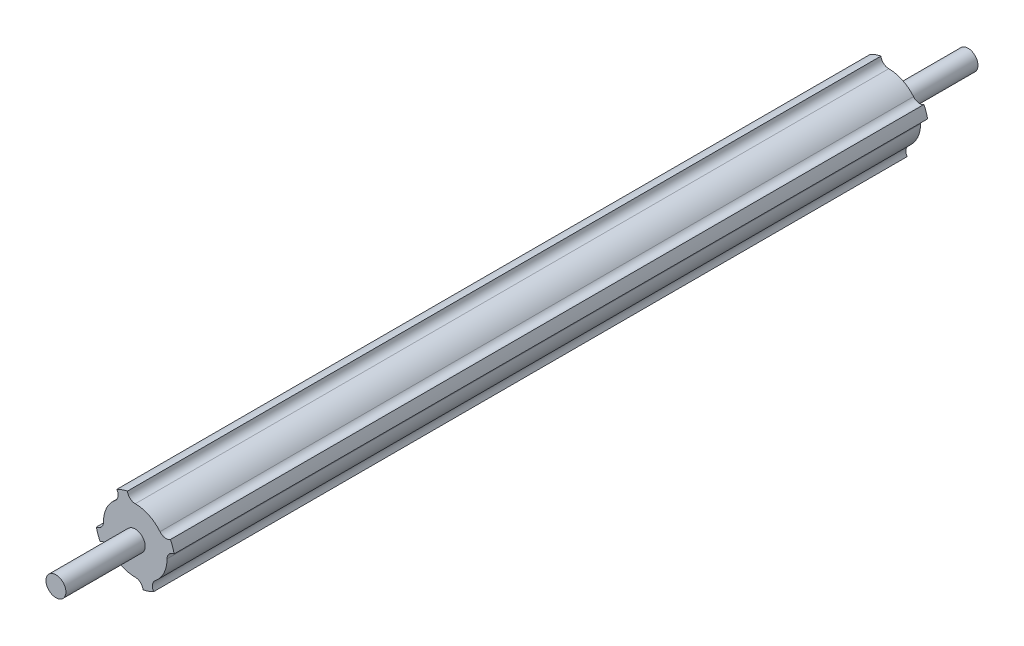
from build123d import *

# Parameters (mm, degrees)
SKETCH1_R           = 25.4
BOSS_EXTRUDE1_DEPTH = 584.2
SKETCH2_OUTSIDE_W   = 170.52
SKETCH2_OUTSIDE_H   = 170.52
SKETCH2_OUTSIDE_R   = 6.361935525
CUT_EXTRUDE1_DEPTH  = 50.8
SKETCH5_OUTSIDE_W   = 170.52
SKETCH5_OUTSIDE_H   = 170.52
SKETCH5_OUTSIDE_R   = 6.377907631
CUT_EXTRUDE4_DEPTH  = 50.8
CUT_EXTRUDE5_DEPTH  = 535.94
CIRPATTERN1_COUNT   = 4


with BuildPart() as part:
    # Sketch1 → Boss-Extrude1 (new body)
    with BuildSketch(Plane.XY):
        Circle(SKETCH1_R)
    extrude(amount=BOSS_EXTRUDE1_DEPTH)

    # Sketch2 outside → Cut-Extrude1 (cut)
    with BuildSketch(Plane.XY):
        Rectangle(SKETCH2_OUTSIDE_W, SKETCH2_OUTSIDE_H)
        Circle(SKETCH2_OUTSIDE_R, mode=Mode.SUBTRACT)
    extrude(amount=CUT_EXTRUDE1_DEPTH, mode=Mode.SUBTRACT)

    # Sketch5 outside → Cut-Extrude4 (cut)
    with BuildSketch(Plane.XY.offset(584.2)):
        Rectangle(SKETCH5_OUTSIDE_W, SKETCH5_OUTSIDE_H)
        Circle(SKETCH5_OUTSIDE_R, mode=Mode.SUBTRACT)
    extrude(amount=-CUT_EXTRUDE4_DEPTH, mode=Mode.SUBTRACT)

    # Sketch13 → Cut-Extrude5 (cut)
    with BuildSketch(Plane.XY.offset(584.2)):
        with BuildLine():
            ThreePointArc((23.648188812, 19.127264814), (13.102061479, 27.448589733), (0, 30.415277302))
            ThreePointArc((0, 30.415277302), (-5.015277302, 25.4), (0, 20.384722698))
            ThreePointArc((0, 20.384722698), (8.781175571, 18.396409298), (15.84933014, 12.819346848))
            ThreePointArc((15.84933014, 12.819346848), (22.902718459, 12.073876495), (23.648188812, 19.127264814))
        make_face()
    cut_extrude5 = extrude(amount=-CUT_EXTRUDE5_DEPTH, mode=Mode.SUBTRACT)

    # CirPattern1: Cut-Extrude5 ×4 about axis
    cirpattern1_axis = Axis((0, 0, 533.4), (0, 0, -1))
    for i in range(1, CIRPATTERN1_COUNT):
        add(cut_extrude5.rotate(cirpattern1_axis, i * 360 / CIRPATTERN1_COUNT), mode=Mode.SUBTRACT)


solid = part.part
